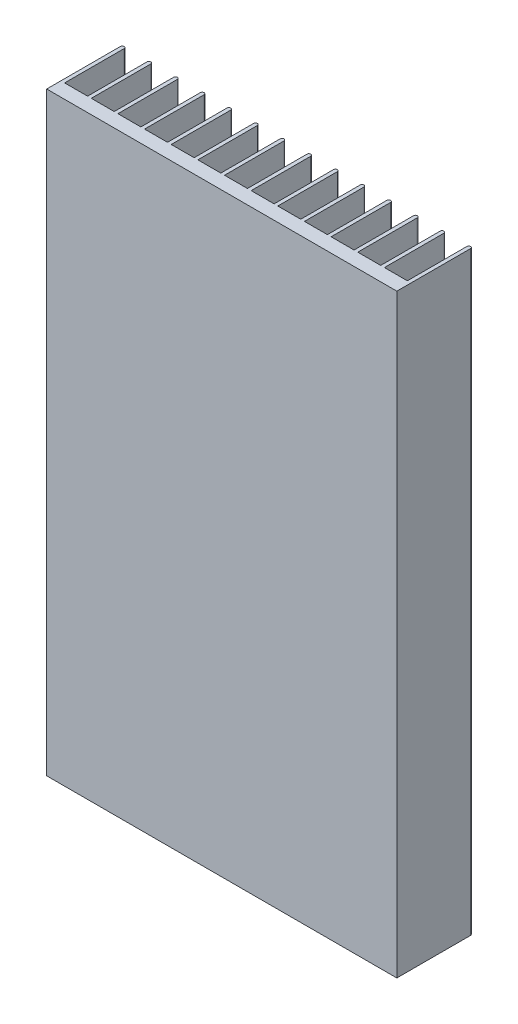
from build123d import *

# Parameters (mm, degrees)
BOSS_EXTRUDE1_DEPTH = 254


with BuildPart() as part:
    # Sketch1 → Boss-Extrude1 (new body)
    with BuildSketch(Plane(origin=(0, 0, 0), x_dir=(1, 0, 0), z_dir=(0, 1, 0))):
        with BuildLine():
            Line((0, 0), (149.5044, 0))
            Line((149.5044, 0), (149.5044, 6.0706))
            Line((149.5044, 6.0706), (149.5044, 31.4706))
            ThreePointArc((149.5044, 31.4706), (148.717, 32.258), (147.9296, 31.4706))
            Line((147.9296, 31.4706), (147.9296, 6.0706))
            Line((147.9296, 6.0706), (138.1252, 6.0706))
            Line((138.1252, 6.0706), (138.1252, 31.4706))
            ThreePointArc((138.1252, 31.4706), (137.3378, 32.258), (136.5504, 31.4706))
            Line((136.5504, 31.4706), (136.5504, 6.0706))
            Line((136.5504, 6.0706), (126.746, 6.0706))
            Line((126.746, 6.0706), (126.746, 31.4706))
            ThreePointArc((126.746, 31.4706), (125.9586, 32.258), (125.1712, 31.4706))
            Line((125.1712, 31.4706), (125.1712, 6.0706))
            Line((125.1712, 6.0706), (115.3668, 6.0706))
            Line((115.3668, 6.0706), (115.3668, 31.4706))
            ThreePointArc((115.3668, 31.4706), (114.5794, 32.258), (113.792, 31.4706))
            Line((113.792, 31.4706), (113.792, 6.0706))
            Line((113.792, 6.0706), (103.9876, 6.0706))
            Line((103.9876, 6.0706), (103.9876, 31.4706))
            ThreePointArc((103.9876, 31.4706), (103.2002, 32.258), (102.4128, 31.4706))
            Line((102.4128, 31.4706), (102.4128, 6.0706))
            Line((102.4128, 6.0706), (92.6084, 6.0706))
            Line((92.6084, 6.0706), (92.6084, 31.4706))
            ThreePointArc((92.6084, 31.4706), (91.821, 32.258), (91.0336, 31.4706))
            Line((91.0336, 31.4706), (91.0336, 6.0706))
            Line((91.0336, 6.0706), (81.2292, 6.0706))
            Line((81.2292, 6.0706), (81.2292, 31.4706))
            ThreePointArc((81.2292, 31.4706), (80.4418, 32.258), (79.6544, 31.4706))
            Line((79.6544, 31.4706), (79.6544, 6.0706))
            Line((79.6544, 6.0706), (69.85, 6.0706))
            Line((69.85, 6.0706), (69.85, 31.4706))
            ThreePointArc((69.85, 31.4706), (69.0626, 32.258), (68.2752, 31.4706))
            Line((68.2752, 31.4706), (68.2752, 6.0706))
            Line((68.2752, 6.0706), (58.4708, 6.0706))
            Line((58.4708, 6.0706), (58.4708, 31.4706))
            ThreePointArc((58.4708, 31.4706), (57.6834, 32.258), (56.896, 31.4706))
            Line((56.896, 31.4706), (56.896, 6.0706))
            Line((56.896, 6.0706), (47.0916, 6.0706))
            Line((47.0916, 6.0706), (47.0916, 31.4706))
            ThreePointArc((47.0916, 31.4706), (46.3042, 32.258), (45.5168, 31.4706))
            Line((45.5168, 31.4706), (45.5168, 6.0706))
            Line((45.5168, 6.0706), (35.7124, 6.0706))
            Line((35.7124, 6.0706), (35.7124, 31.4706))
            ThreePointArc((35.7124, 31.4706), (34.925, 32.258), (34.1376, 31.4706))
            Line((34.1376, 31.4706), (34.1376, 6.0706))
            Line((34.1376, 6.0706), (24.3332, 6.0706))
            Line((24.3332, 6.0706), (24.3332, 31.4706))
            ThreePointArc((24.3332, 31.4706), (23.5458, 32.258), (22.7584, 31.4706))
            Line((22.7584, 31.4706), (22.7584, 6.0706))
            Line((22.7584, 6.0706), (12.954, 6.0706))
            Line((12.954, 6.0706), (12.954, 31.4706))
            ThreePointArc((12.954, 31.4706), (12.1666, 32.258), (11.3792, 31.4706))
            Line((11.3792, 31.4706), (11.3792, 6.0706))
            Line((11.3792, 6.0706), (1.5748, 6.0706))
            Line((1.5748, 6.0706), (1.5748, 31.4706))
            ThreePointArc((1.5748, 31.4706), (0.7874, 32.258), (0, 31.4706))
            Line((0, 31.4706), (0, 0))
        make_face()
    extrude(amount=BOSS_EXTRUDE1_DEPTH)


solid = part.part
